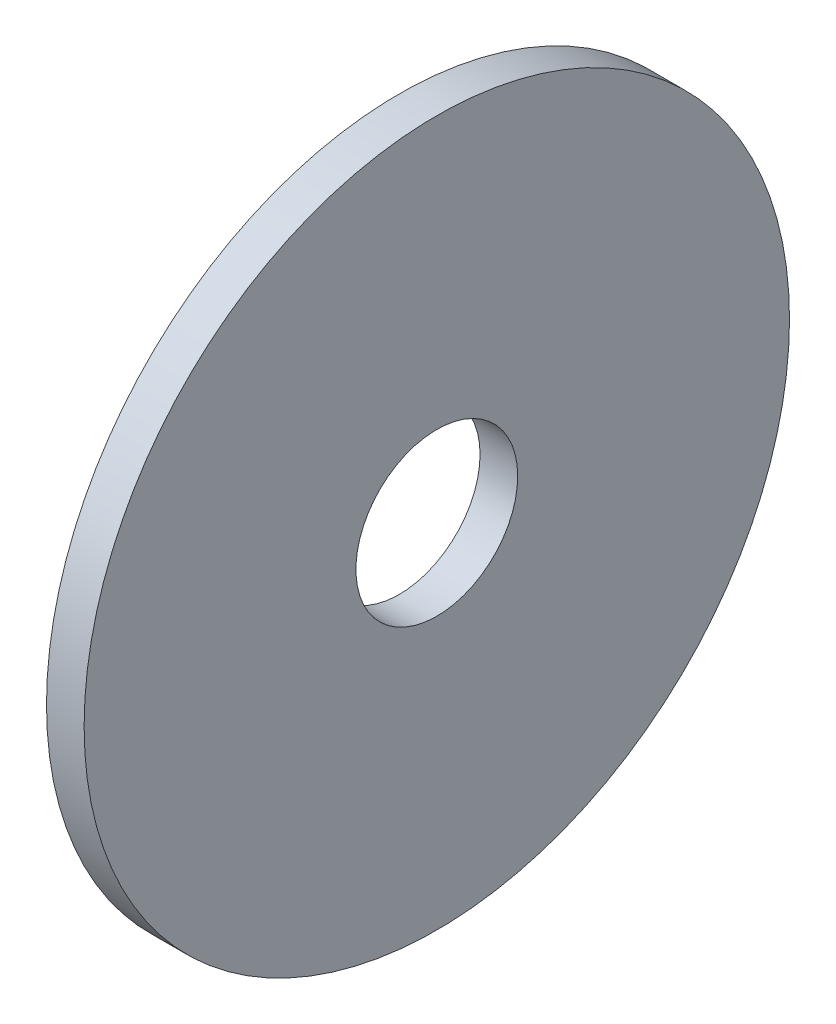
from build123d import *

# Parameters (mm, degrees)
SKETCH1_R           = 19.05
SKETCH1_R_2         = 4.3688
BOSS_EXTRUDE1_DEPTH = 2.032


with BuildPart() as part:
    # Sketch1 → Boss-Extrude1 (new body)
    with BuildSketch(Plane(origin=(0, 0, 0), x_dir=(0, 0, -1), z_dir=(1, 0, 0))):
        Circle(SKETCH1_R)
        Circle(SKETCH1_R_2, mode=Mode.SUBTRACT)
    extrude(amount=BOSS_EXTRUDE1_DEPTH)


solid = part.part
